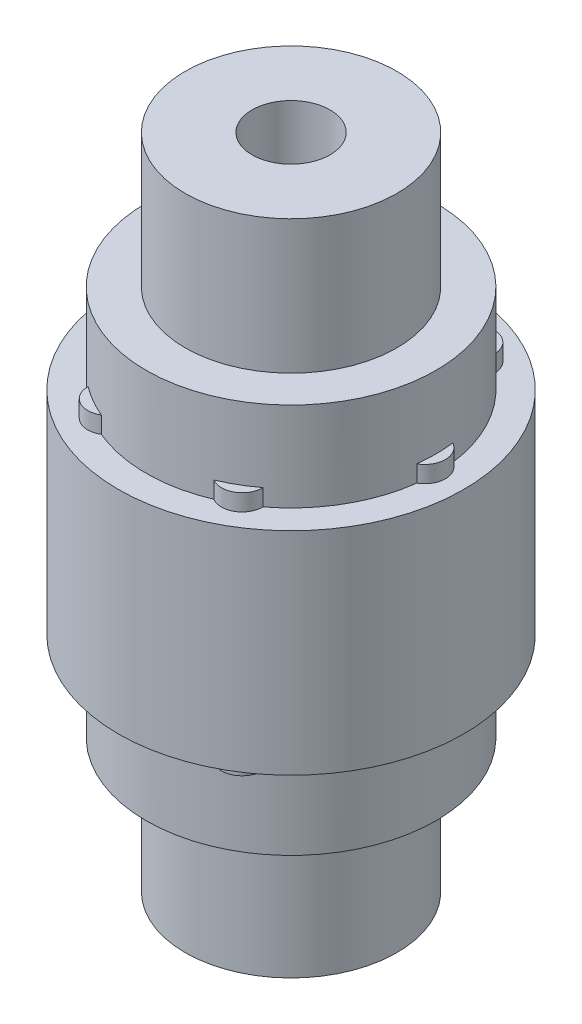
from build123d import *

# Parameters (mm, degrees)
SKETCH1_R                   = 19
SKETCH1_R_2                 = 7
CONNECTOR_AXLE_SLEEVE_DEPTH = 59
SKETCH2_R                   = 31
SKETCH2_R_2                 = 11
OUTER_BOLT_FLANGE_DEPTH     = 19
SKETCH3_R                   = 26
SKETCH3_R_2                 = 9
STEPPED_HUB_SHOULDER_DEPTH  = 35
SKETCH4_R                   = 3.7
BOLT_CIRCLE_PAD_1_DEPTH     = 22
SKETCH5_R                   = 3.7
BOLT_CIRCLE_PAD_2_DEPTH     = 22
SKETCH6_R                   = 3.7
BOLT_CIRCLE_PAD_3_DEPTH     = 22
SKETCH7_R                   = 3.7
BOLT_CIRCLE_PAD_4_DEPTH     = 22
SKETCH8_R                   = 3.7
BOLT_CIRCLE_PAD_5_DEPTH     = 22
SKETCH9_R                   = 3.7
BOLT_CIRCLE_PAD_6_DEPTH     = 22


with BuildPart() as part:
    # Sketch1 → connector axle sleeve (new, symmetric)
    with BuildSketch(Plane(origin=(0, 0, 0), x_dir=(1, 0, 0), z_dir=(0, 1, 0))):
        with Locations(Location((0, 0, 0), (0, 0, 270))):
            Circle(SKETCH1_R)
        with Locations(Location((0, 0, 0), (0, 0, 270))):
            Circle(SKETCH1_R_2, mode=Mode.SUBTRACT)
    extrude(amount=CONNECTOR_AXLE_SLEEVE_DEPTH, both=True)

    # Sketch2 → outer bolt flange (add, symmetric)
    with BuildSketch(Plane(origin=(0, 0, 0), x_dir=(1, 0, 0), z_dir=(0, 1, 0))):
        with Locations(Location((0, 0, 0), (0, 0, 270))):
            Circle(SKETCH2_R)
        Circle(SKETCH2_R_2, mode=Mode.SUBTRACT)
    extrude(amount=OUTER_BOLT_FLANGE_DEPTH, both=True)

    # Sketch3 → stepped hub shoulder (add, symmetric)
    with BuildSketch(Plane(origin=(0, 0, 0), x_dir=(1, 0, 0), z_dir=(0, 1, 0))):
        with Locations(Location((0, 0, 0), (0, 0, 270))):
            Circle(SKETCH3_R)
        Circle(SKETCH3_R_2, mode=Mode.SUBTRACT)
    extrude(amount=STEPPED_HUB_SHOULDER_DEPTH, both=True)

    # Sketch4 → bolt circle pad 1 (add, symmetric)
    with BuildSketch(Plane(origin=(0, 0, 0), x_dir=(1, 0, 0), z_dir=(0, 1, 0))):
        with Locations((24, 0)):
            Circle(SKETCH4_R)
    extrude(amount=BOLT_CIRCLE_PAD_1_DEPTH, both=True)

    # Sketch5 → bolt circle pad 2 (add, symmetric)
    with BuildSketch(Plane(origin=(0, 0, 0), x_dir=(1, 0, 0), z_dir=(0, 1, 0))):
        with Locations((12, 20.784609691)):
            Circle(SKETCH5_R)
    extrude(amount=BOLT_CIRCLE_PAD_2_DEPTH, both=True)

    # Sketch6 → bolt circle pad 3 (add, symmetric)
    with BuildSketch(Plane(origin=(0, 0, 0), x_dir=(1, 0, 0), z_dir=(0, 1, 0))):
        with Locations((-12, 20.784609691)):
            Circle(SKETCH6_R)
    extrude(amount=BOLT_CIRCLE_PAD_3_DEPTH, both=True)

    # Sketch7 → bolt circle pad 4 (add, symmetric)
    with BuildSketch(Plane(origin=(0, 0, 0), x_dir=(1, 0, 0), z_dir=(0, 1, 0))):
        with Locations((-24, 0)):
            Circle(SKETCH7_R)
    extrude(amount=BOLT_CIRCLE_PAD_4_DEPTH, both=True)

    # Sketch8 → bolt circle pad 5 (add, symmetric)
    with BuildSketch(Plane(origin=(0, 0, 0), x_dir=(1, 0, 0), z_dir=(0, 1, 0))):
        with Locations((-12, -20.784609691)):
            Circle(SKETCH8_R)
    extrude(amount=BOLT_CIRCLE_PAD_5_DEPTH, both=True)

    # Sketch9 → bolt circle pad 6 (add, symmetric)
    with BuildSketch(Plane(origin=(0, 0, 0), x_dir=(1, 0, 0), z_dir=(0, 1, 0))):
        with Locations((12, -20.784609691)):
            Circle(SKETCH9_R)
    extrude(amount=BOLT_CIRCLE_PAD_6_DEPTH, both=True)


solid = part.part
